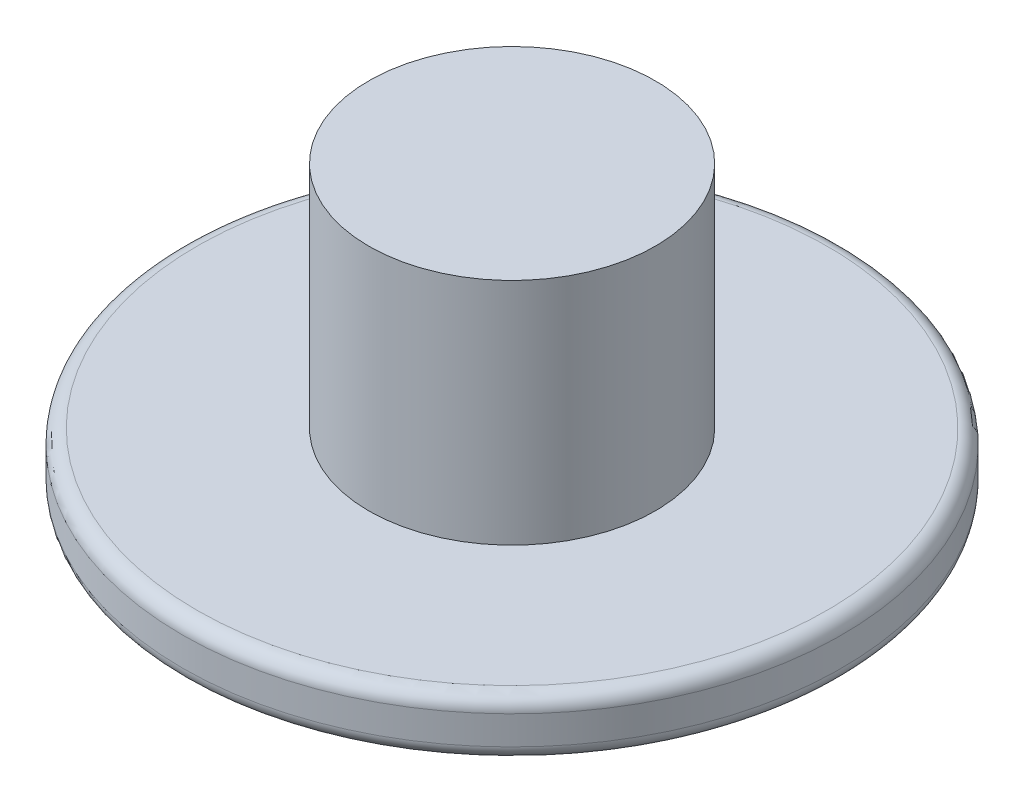
from build123d import *

# Parameters (mm, degrees)
SKETCH1_R           = 11.5
BOSS_EXTRUDE5_DEPTH = 2
SKETCH4_R           = 5
BOSS_EXTRUDE6_DEPTH = 8
CUT_EXTRUDE2_DEPTH  = 0.5
FILLET1_R           = 0.5


with BuildPart() as part:
    # Sketch1 → Boss-Extrude5 (new body)
    with BuildSketch(Plane(origin=(0, 0, 0), x_dir=(1, 0, 0), z_dir=(0, 1, 0))):
        with Locations(Location((-5.408676197, -40.3067379, 0), (0, 0, 270))):
            Circle(SKETCH1_R)
    extrude(amount=BOSS_EXTRUDE5_DEPTH)

    # Sketch4 → Boss-Extrude6 (add)
    with BuildSketch(Plane(origin=(0, 2, 0), x_dir=(1, 0, 0), z_dir=(0, 1, 0))):
        with Locations(Location((-5.408676197, -40.3067379, 0), (0, 0, 270))):
            Circle(SKETCH4_R)
    extrude(amount=BOSS_EXTRUDE6_DEPTH)

    # Sketch5 → Cut-Extrude2 (cut)
    # profile 1 of 2: a face of its own
    with BuildSketch(Plane.XZ):
        Polygon((-11.816511362, 36.397340578), (-9.664612628, 36.397340578), (-9.664612628, 44.372024123), (-12.069675919, 43.865695009), (-12.069675919, 44.878353237), (-9.644834147, 45.38468235), (-8.272207565, 45.38468235), (-8.272207565, 36.397340578), (-6.120308831, 36.397340578), (-6.120308831, 35.38468235), (-11.816511362, 35.38468235), align=None)
    # profile 2 of 2: a face of its own
    with BuildSketch(Plane.XZ):
        with BuildLine():
            add(Edge.make_bspline(
                [(-0.550688578, 45.637846907), (-0.415938804, 45.633730166), (-0.152802852, 45.625691098), (0.229163714, 45.561237383), (0.586683797, 45.456245103), (0.920332152, 45.309789042), (1.227359965, 45.117028679), (1.510292763, 44.884079449), (1.767374377, 44.607527173), (1.998267531, 44.289408333), (2.204159406, 43.931981409), (2.381194089, 43.535679405), (2.534314002, 43.103516508), (2.654820834, 42.631767759), (2.752456274, 42.123354369), (2.816869131, 41.576005545), (2.859979178, 40.99125567), (2.864632597, 40.588485261), (2.867032941, 40.380726654)],
                knots=[0, 0, 0, 0, 0.914621173, 1.786049105, 2.621809963, 3.439570598, 4.25200759, 5.075726843, 5.921440778, 6.808834034, 7.739519474, 8.717306742, 9.75236949, 10.849108534, 12.020406428, 13.265380358, 14.589417808, 16, 16, 16, 16], degree=3))
            add(Edge.make_bspline(
                [(2.867032941, 40.380726654), (2.864644222, 40.173625568), (2.86001379, 39.772168798), (2.816709133, 39.188761145), (2.752698639, 38.642668217), (2.654549419, 38.135010363), (2.534332528, 37.663871958), (2.381219253, 37.231685314), (2.204051011, 36.835485659), (1.998914362, 36.478161083), (1.766700275, 36.161674678), (1.510372243, 35.885227112), (1.227339233, 35.652351187), (0.92033771, 35.459571593), (0.58668227, 35.313120715), (0.229164144, 35.208127003), (-0.152802968, 35.143673687), (-0.415938843, 35.135634563), (-0.550688578, 35.131517794)],
                knots=[0, 0, 0, 0, 1.407597425, 2.728568576, 3.974862697, 5.143000578, 6.240902623, 7.277062968, 8.255887098, 9.187559452, 10.072280029, 10.918890773, 11.743483511, 12.556782025, 13.375409826, 14.212056939, 15.084408948, 16, 16, 16, 16], degree=3))
            add(Edge.make_bspline(
                [(-0.550688578, 35.131517794), (-0.6854385, 35.135634386), (-0.948574743, 35.143673163), (-1.330539237, 35.208128951), (-1.688066752, 35.313113795), (-2.021688201, 35.459596777), (-2.328815845, 35.652257252), (-2.611716883, 35.885875244), (-2.870168983, 36.160946148), (-3.102194243, 36.478253797), (-3.307287706, 36.835508053), (-3.48508341, 37.231281228), (-3.635082086, 37.66432144), (-3.756126667, 38.134940569), (-3.854016818, 38.642688789), (-3.91810349, 39.188755145), (-3.961386204, 39.772170452), (-3.966019764, 40.173626131), (-3.968410097, 40.380726654)],
                knots=[0, 0, 0, 0, 0.915500487, 1.787766207, 2.624330562, 3.442877389, 4.256095455, 5.080606629, 5.930200102, 6.814833167, 7.746413364, 8.725140674, 9.759714696, 10.857508142, 12.025530477, 13.27170132, 14.592541807, 16, 16, 16, 16], degree=3))
            add(Edge.make_bspline(
                [(-3.968410097, 40.380726654), (-3.966008131, 40.588484695), (-3.961351569, 40.991254008), (-3.918263552, 41.576011567), (-3.853774368, 42.123333768), (-3.756398925, 42.631837847), (-3.63506368, 43.103067057), (-3.485058278, 43.536083527), (-3.307396088, 43.931958995), (-3.101547546, 44.289315613), (-2.870846186, 44.608258357), (-2.611637461, 44.883431398), (-2.32883653, 45.117122569), (-2.021682655, 45.30976387), (-1.688068275, 45.45625202), (-1.330538808, 45.561235436), (-0.948574858, 45.625691622), (-0.685438539, 45.633730344), (-0.550688578, 45.637846907)],
                knots=[0, 0, 0, 0, 1.410442812, 2.734349433, 3.979200347, 5.150382505, 6.24701318, 7.280491394, 8.258182046, 9.188775525, 10.076081097, 10.924774691, 11.748412552, 12.560769267, 13.378449099, 14.214127375, 15.085469201, 16, 16, 16, 16], degree=3))
        make_face()
        with BuildLine():
            add(Edge.make_bspline(
                [(-0.554644274, 44.62518868), (-0.635989574, 44.622401752), (-0.795646719, 44.616931825), (-1.026841529, 44.566459489), (-1.242386869, 44.482103579), (-1.441486777, 44.363897306), (-1.625737076, 44.213545447), (-1.792639211, 44.028975958), (-1.943217724, 43.811177792), (-2.076899469, 43.560448999), (-2.195580983, 43.277641024), (-2.297639092, 42.961856636), (-2.383967094, 42.612798562), (-2.454448483, 42.230321244), (-2.509050303, 41.815044266), (-2.548039786, 41.366310053), (-2.571798824, 40.8846772), (-2.574574099, 40.552168459), (-2.576005033, 40.380726654)],
                knots=[0, 0, 0, 0, 0.748569641, 1.469224287, 2.167313872, 2.872447611, 3.593306944, 4.349889458, 5.156880845, 6.026416454, 6.962619852, 7.978571635, 9.080333099, 10.272657594, 11.559295133, 12.937179704, 14.420807114, 16, 16, 16, 16], degree=3))
            add(Edge.make_bspline(
                [(-2.576005033, 40.380726654), (-2.574582635, 40.209943239), (-2.571824242, 39.878750606), (-2.547925246, 39.398448218), (-2.509225008, 38.951001137), (-2.45425411, 38.536431355), (-2.383976272, 38.154591028), (-2.297666503, 37.805513593), (-2.195476658, 37.489802584), (-2.077472273, 37.20728493), (-1.942625912, 36.957849971), (-1.792702591, 36.740354541), (-1.625721415, 36.555827706), (-1.441490789, 36.40546523), (-1.242385817, 36.287261689), (-1.026841818, 36.202905056), (-0.795646642, 36.152432918), (-0.635989549, 36.146962963), (-0.554644274, 36.144176021)],
                knots=[0, 0, 0, 0, 1.575434164, 3.05516895, 4.435080037, 5.717581461, 6.91165956, 8.015041434, 9.032487421, 9.970067734, 10.835534704, 11.643712969, 12.401408222, 13.123327754, 13.829498565, 14.528614861, 15.250329405, 16, 16, 16, 16], degree=3))
            add(Edge.make_bspline(
                [(-0.554644274, 36.144176021), (-0.472616683, 36.146871841), (-0.312254594, 36.152142109), (-0.0794757, 36.203726771), (0.138133244, 36.286201975), (0.338090945, 36.405582767), (0.522379645, 36.55579412), (0.689341824, 36.740364859), (0.839280394, 36.957844948), (0.974082065, 37.207294623), (1.092268814, 37.489765126), (1.193740002, 37.805824707), (1.283313605, 38.15424386), (1.352654751, 38.536487567), (1.407914192, 38.950984355), (1.446528422, 39.398453194), (1.470452529, 39.878749229), (1.473207332, 40.20994277), (1.474627878, 40.380726654)],
                knots=[0, 0, 0, 0, 0.75484838, 1.475711535, 2.185326637, 2.890664395, 3.611732298, 4.368533717, 5.175758594, 6.040204595, 6.976678868, 7.992924601, 9.096493949, 10.289163424, 11.570151914, 12.948435155, 14.426424335, 16, 16, 16, 16], degree=3))
            add(Edge.make_bspline(
                [(1.474627878, 40.380726654), (1.473198806, 40.55216893), (1.470427142, 40.884678585), (1.446642874, 41.366305056), (1.407739604, 41.815061077), (1.352847963, 42.230264739), (1.28330429, 42.6131457), (1.193712582, 42.961545506), (1.092373097, 43.277678471), (0.973509023, 43.560439245), (0.839872237, 43.811182841), (0.689278446, 44.028965642), (0.522395306, 44.213579032), (0.338086936, 44.363779771), (0.138134314, 44.483163303), (-0.079475991, 44.565637773), (-0.312254517, 44.617222634), (-0.472616657, 44.622492874), (-0.554644274, 44.62518868)],
                knots=[0, 0, 0, 0, 1.577332685, 3.059212465, 4.435473965, 5.720595916, 6.91151592, 8.013466492, 9.028221541, 9.963322143, 10.831833488, 11.637874284, 12.393565586, 13.113575787, 13.817878918, 14.526453118, 15.246258873, 16, 16, 16, 16], degree=3))
        make_face(mode=Mode.SUBTRACT)
    extrude(amount=-CUT_EXTRUDE2_DEPTH, mode=Mode.SUBTRACT)

    # Fillet1
    fillet1_edges = [part.edges().sort_by_distance(p)[0] for p in [
        (-5.408676197, 0, 28.8067379),
        (-5.408676197, 2, 28.8067379),
    ]]
    fillet(fillet1_edges, radius=FILLET1_R)


solid = part.part
